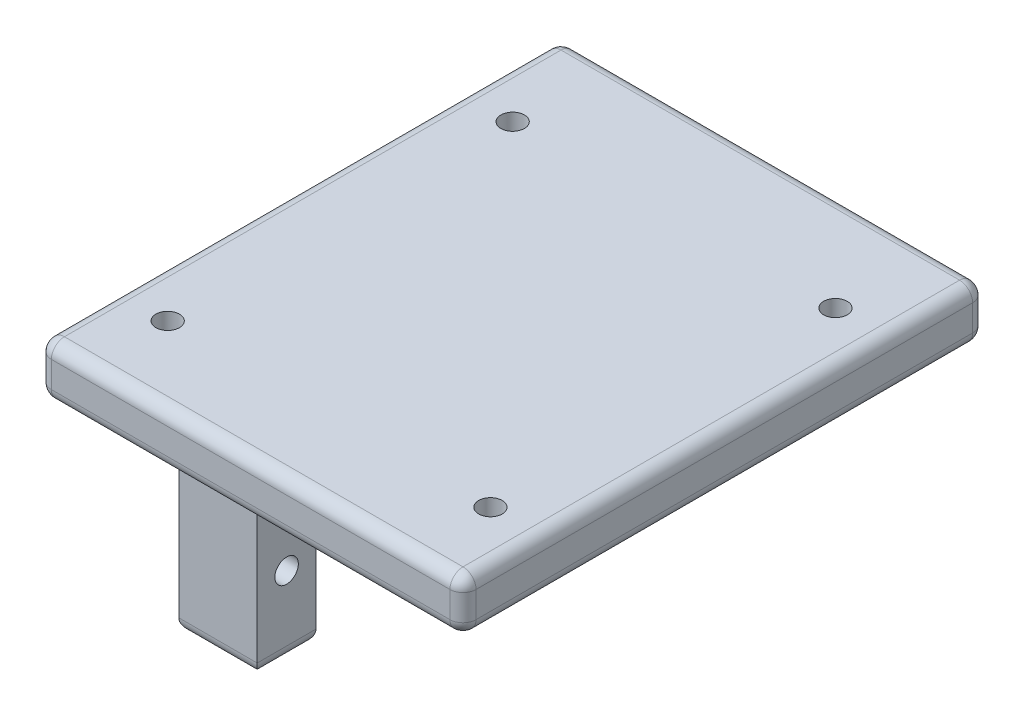
from build123d import *

# Parameters (mm, degrees)
SKETCH1_W                     = 32.5
SKETCH1_H                     = 40
BASE_DEPTH                    = 4
SKETCH4_R                     = 0.9
SCANNER_MOUNTING_HOLES_DEPTH  = 44.359687499
SKETCH6_W                     = 6
SKETCH6_H                     = 4.5
SERVO_MOUNTING_PLATFORM_DEPTH = 14
SERVO_MOUNTING_HOLES_REACH    = 51.46
SKETCH7_R                     = 0.9
FILLET1_R                     = 1


with BuildPart() as part:
    # Sketch1 → Base (new body)
    with BuildSketch(Plane(origin=(0, 0, 0), x_dir=(1, 0, 0), z_dir=(0, 1, 0))):
        with Locations((0, 20)):
            Rectangle(SKETCH1_W, SKETCH1_H)
    extrude(amount=BASE_DEPTH)

    # Sketch4 → Scanner Mounting Holes (cut, through all)
    with BuildSketch(Plane.XZ):
        with Locations(Location((-12.35, -6, 0), (0, 0, 270))):
            Circle(SKETCH4_R)
        with Locations(Location((-12.35, -32.4, 0), (0, 0, 270))):
            Circle(SKETCH4_R)
        with Locations(Location((12.35, -32.4, 0), (0, 0, 90))):
            Circle(SKETCH4_R)
        with Locations(Location((12.35, -6, 0), (0, 0, 90))):
            Circle(SKETCH4_R)
    extrude(amount=-SCANNER_MOUNTING_HOLES_DEPTH, mode=Mode.SUBTRACT)

    # Sketch6 → Servo Mounting Platform (add)
    with BuildSketch(Plane.XZ):
        with Locations((-6.25, -6)):
            Rectangle(SKETCH6_W, SKETCH6_H)
        with Locations((-6.25, -33.8)):
            Rectangle(SKETCH6_W, SKETCH6_H)
    extrude(amount=SERVO_MOUNTING_PLATFORM_DEPTH)

    # Sketch7 → Servo Mounting Holes (cut, up to next)
    with BuildSketch(Plane.ZY.offset(9.25), mode=Mode.PRIVATE) as servo_mounting_holes_sk1:
        with Locations((-33.8, -8)):
            Circle(SKETCH7_R)
    servo_mounting_holes_tool1 = extrude(servo_mounting_holes_sk1.sketch, amount=-SERVO_MOUNTING_HOLES_REACH, mode=Mode.PRIVATE) & part.part
    # Sketch7 → Servo Mounting Holes (cut, up to next)
    with BuildSketch(Plane.ZY.offset(9.25), mode=Mode.PRIVATE) as servo_mounting_holes_sk2:
        with Locations((-6, -8)):
            Circle(SKETCH7_R)
    servo_mounting_holes_tool2 = extrude(servo_mounting_holes_sk2.sketch, amount=-SERVO_MOUNTING_HOLES_REACH, mode=Mode.PRIVATE) & part.part
    add(servo_mounting_holes_tool1.solids().sort_by_distance((-9.25, -8, -33.8))[0], mode=Mode.SUBTRACT)
    add(servo_mounting_holes_tool2.solids().sort_by_distance((-9.25, -8, -6))[0], mode=Mode.SUBTRACT)

    # Fillet1
    fillet1_edges = [part.edges().sort_by_distance(p)[0] for p in [
        (16.25, 4, -20),
        (0, 4, -40),
        (-6.25, 0, -8.25),
        (-6.25, 0, -3.75),
        (-9.25, -14, -6),
        (-6.25, -14, -8.25),
        (-3.25, -14, -6),
        (-6.25, -14, -3.75),
        (-6.25, 0, -36.05),
        (-6.25, 0, -31.55),
        (-9.25, -14, -33.8),
        (-6.25, -14, -36.05),
        (-3.25, -14, -33.8),
        (-6.25, -14, -31.55),
        (-16.25, 4, -20),
        (0, 0, -40),
        (16.25, 0, -20),
        (0, 0, 0),
        (-16.25, 0, -20),
        (-16.25, 2, -40),
        (16.25, 2, -40),
        (16.25, 2, 0),
        (-16.25, 2, 0),
        (0, 4, 0),
    ]]
    fillet(fillet1_edges, radius=FILLET1_R)


solid = part.part
